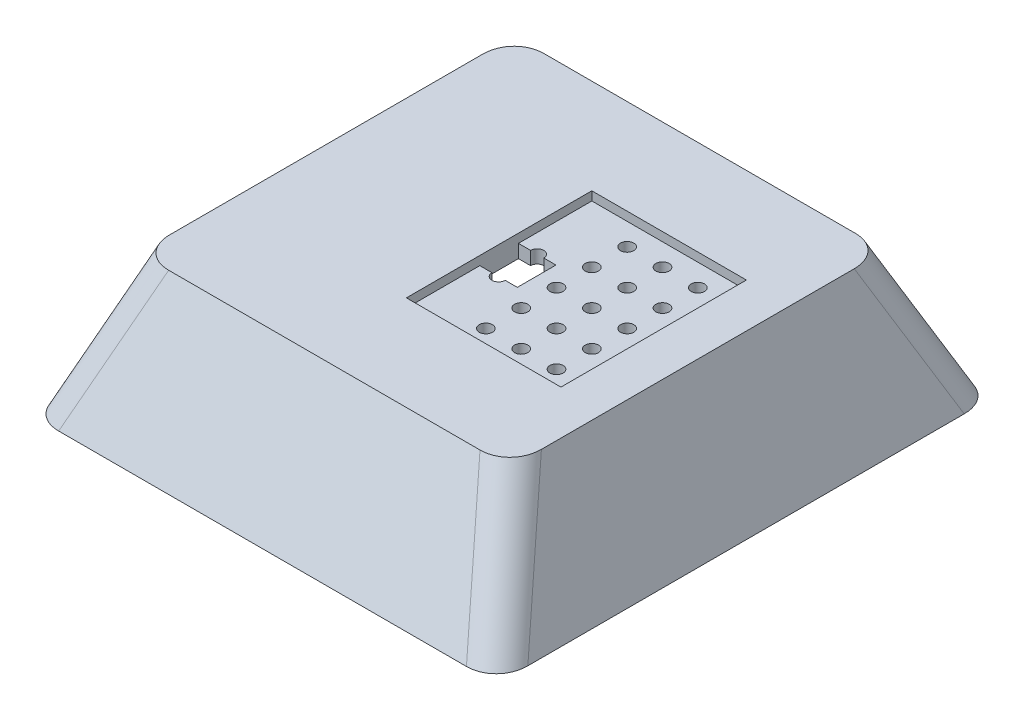
from build123d import *

# Parameters (mm, degrees)
TOP_ENCLOSURE_DEPTH                     = 65
TOP_EXTRA_DEPTH                         = 10
SKETCH3_W                               = 35
SKETCH3_H                               = 42
SOLAR_CELL_SLOT_DEPTH                   = 2
SKETCH4_R                               = 1.5
SOLAR_CELL_HOLES_DEPTH                  = 97.010416102
BOSS_EXTRUDE1_REACH                     = 97.584
BOSS_EXTRUDE2_REACH                     = 108.913
FILLET1_R                               = 7.5
CBORE_FOR_M5_HEX_HEAD_BOLT1_D           = 5.3
CBORE_FOR_M5_HEX_HEAD_BOLT1_DEPTH       = 10
CBORE_FOR_M5_HEX_HEAD_BOLT1_CBORE_D     = 7
CBORE_FOR_M5_HEX_HEAD_BOLT1_CBORE_DEPTH = 5


with BuildPart() as part:
    # Master_Geometry → Top_Enclosure (new body)
    with BuildSketch(Plane.XY):
        Polygon((-48, -3.5), (-53, -3.5), (-42.080892972, 26.5), (42.080892972, 26.5), (53, -3.5), (48, -3.5), (48, 4), (38, 4), (38, 21.5), (-38, 21.5), (-38, 4), (-48, 4), align=None)
    extrude(amount=TOP_ENCLOSURE_DEPTH)

    # Sketch2 → Top_Extra (add)
    with BuildSketch(Plane.XY.offset(65)):
        Polygon((-42.080892972, 26.5), (42.080892972, 26.5), (53, -3.5), (-53, -3.5), align=None)
    top_extra = extrude(amount=TOP_EXTRA_DEPTH)

    # Mirror1: Top_Extra across plane
    add(top_extra.mirror(Plane(origin=(0, 0, 32.5), x_dir=(1, 0, 0), z_dir=(0, 0, -1))))

    # Sketch3 → Solar_Cell_Slot (cut)
    with BuildSketch(Plane(origin=(0, 26.5, 0), x_dir=(1, 0, 0), z_dir=(0, 1, 0))):
        with Locations((14.580892972, -32.5)):
            Rectangle(SKETCH3_W, SKETCH3_H)
    extrude(amount=-SOLAR_CELL_SLOT_DEPTH, mode=Mode.SUBTRACT)

    # Sketch4 → Solar_Cell_Holes (cut, through all)
    with BuildSketch(Plane(origin=(0, 24.5, 0), x_dir=(1, 0, 0), z_dir=(0, 1, 0))):
        with Locations(Location((10.080892972, -32.5, 0), (0, 0, 270))):
            Circle(SKETCH4_R)
        with Locations(Location((18.080892972, -32.5, 0), (0, 0, 270))):
            Circle(SKETCH4_R)
        with Locations(Location((26.080892972, -32.5, 0), (0, 0, 270))):
            Circle(SKETCH4_R)
        with Locations(Location((10.080892972, -40.5, 0), (0, 0, 270))):
            Circle(SKETCH4_R)
        with Locations(Location((18.080892972, -40.5, 0), (0, 0, 270))):
            Circle(SKETCH4_R)
        with Locations(Location((26.080892972, -40.5, 0), (0, 0, 270))):
            Circle(SKETCH4_R)
        with Locations(Location((10.080892972, -48.5, 0), (0, 0, 270))):
            Circle(SKETCH4_R)
        with Locations(Location((18.080892972, -48.5, 0), (0, 0, 270))):
            Circle(SKETCH4_R)
        with Locations(Location((26.080892972, -48.5, 0), (0, 0, 270))):
            Circle(SKETCH4_R)
        with Locations(Location((10.080892972, -24.5, 0), (0, 0, 270))):
            Circle(SKETCH4_R)
        with Locations(Location((18.080892972, -24.5, 0), (0, 0, 270))):
            Circle(SKETCH4_R)
        with Locations(Location((26.080892972, -24.5, 0), (0, 0, 270))):
            Circle(SKETCH4_R)
        with Locations(Location((10.080892972, -16.5, 0), (0, 0, 270))):
            Circle(SKETCH4_R)
        with Locations(Location((18.080892972, -16.5, 0), (0, 0, 270))):
            Circle(SKETCH4_R)
        with Locations(Location((26.080892972, -16.5, 0), (0, 0, 270))):
            Circle(SKETCH4_R)
        with BuildLine():
            Line((2.830892972, -28.125), (5.580892972, -28.125))
            Line((5.580892972, -28.125), (5.580892972, -36.875))
            Line((5.580892972, -36.875), (2.830892972, -36.875))
            ThreePointArc((2.830892972, -36.875), (1.330892972, -38.375), (-0.169107028, -36.875))
            Line((-0.169107028, -36.875), (-2.919107028, -36.875))
            Line((-2.919107028, -36.875), (-2.919107028, -28.125))
            Line((-2.919107028, -28.125), (-0.169107028, -28.125))
            ThreePointArc((-0.169107028, -28.125), (1.330892972, -26.625), (2.830892972, -28.125))
        make_face()
    extrude(amount=-SOLAR_CELL_HOLES_DEPTH, mode=Mode.SUBTRACT)

    # Boss-Extrude1: up to this plane
    boss_extrude1_end = Plane(origin=(42.080892972, 26.5, 65), z_dir=(-0.9396926207859069, -0.3420201433256729, 0))
    # Sketch5 → Boss-Extrude1 (add, up to the surface)
    with BuildSketch(Plane(origin=(0, 0, 0), x_dir=(0, 0, -1), z_dir=(1, 0, 0)), mode=Mode.PRIVATE) as boss_extrude1_sk1:
        Polygon((-75, 26.5), (-75, -3.5), (-88.989229745, -3.5), align=None)
    boss_extrude1_tool1 = split(extrude(boss_extrude1_sk1.sketch, amount=BOSS_EXTRUDE1_REACH, mode=Mode.PRIVATE), bisect_by=boss_extrude1_end, keep=Keep.BOTH, mode=Mode.PRIVATE)
    boss_extrude1 = boss_extrude1_tool1.solids().sort_by_distance((0, 6.5, 79.663077))[0]
    add(boss_extrude1)

    # Boss-Extrude2: up to this face of the body (flat: up to its plane)
    boss_extrude2_end = Plane(part.part.faces().sort_by_distance((-47.540446486, 11.5, 32.5))[0])
    # Sketch6 → Boss-Extrude2 (add, up to the picked face)
    with BuildSketch(Plane.ZY, mode=Mode.PRIVATE) as boss_extrude2_sk1:
        Polygon((75, 26.5), (88.989229745, -3.5), (75, -3.5), align=None)
    boss_extrude2_tool1 = split(extrude(boss_extrude2_sk1.sketch, amount=BOSS_EXTRUDE2_REACH, mode=Mode.PRIVATE), bisect_by=boss_extrude2_end, keep=Keep.BOTH, mode=Mode.PRIVATE)
    boss_extrude2 = boss_extrude2_tool1.solids().sort_by(Axis((0, 6.5, 79.663077), (-1, 0, 0)))[0]
    add(boss_extrude2)

    # Mirror3: Boss-Extrude1, Boss-Extrude2 across plane
    add(boss_extrude1.mirror(Plane(origin=(0, 0, 32.5), x_dir=(1, 0, 0), z_dir=(0, 0, -1))))
    add(boss_extrude2.mirror(Plane(origin=(0, 0, 32.5), x_dir=(1, 0, 0), z_dir=(0, 0, -1))))

    # Fillet1
    fillet1_edges = [part.edges().sort_by_distance(p)[0] for p in [
        (47.540446486, 11.5, 81.994614872),
        (-47.540446486, 11.5, 81.994614872),
        (47.540446486, 11.5, -16.994614872),
        (-47.540446486, 11.5, -16.994614872),
    ]]
    fillet(fillet1_edges, radius=FILLET1_R)

    # CBORE for M5 Hex Head Bolt1
    with Locations(Plane(origin=(0, -3.5, 0), x_dir=(-1, 0, 0), z_dir=(0, -1, 0))):
        with Locations((35, -76.989229745), (0, -76.989229745), (-35, -76.989229745), (-35, 11.989229745), (0, 11.989229745), (35, 11.989229745)):
            CounterBoreHole(CBORE_FOR_M5_HEX_HEAD_BOLT1_D / 2, CBORE_FOR_M5_HEX_HEAD_BOLT1_CBORE_D / 2, CBORE_FOR_M5_HEX_HEAD_BOLT1_CBORE_DEPTH, depth=CBORE_FOR_M5_HEX_HEAD_BOLT1_DEPTH)


solid = part.part
